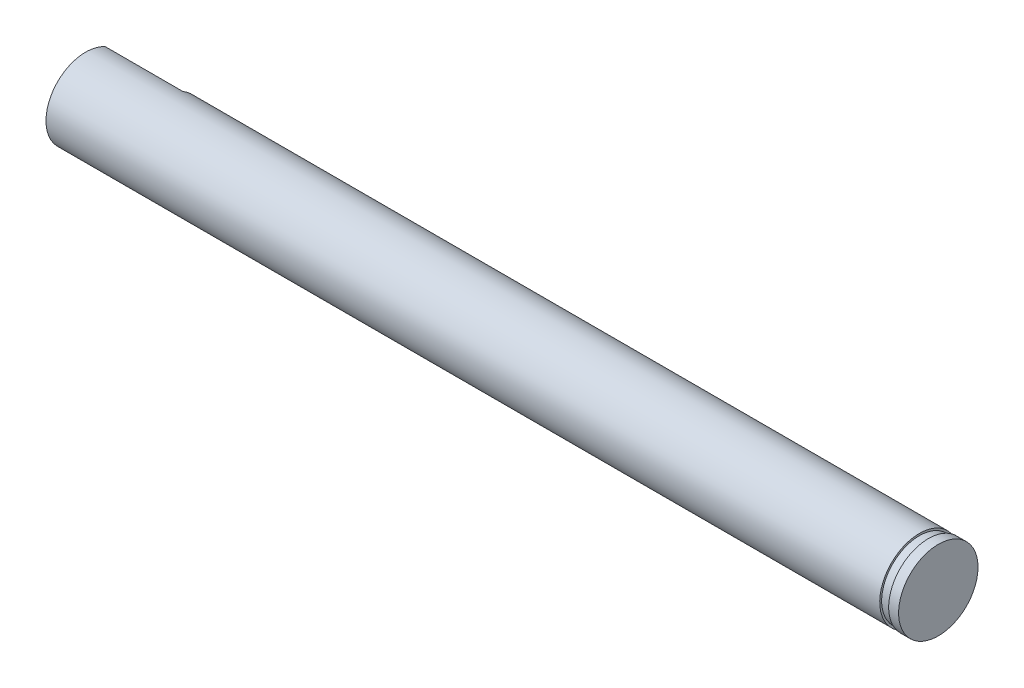
from build123d import *

# Parameters (mm, degrees)
BOSS_EXTRUDE1_DEPTH = 7.8
SKETCH2_R           = 3.995
BOSS_EXTRUDE2_DEPTH = 78
CUT_EXTRUDE1_START  = -1
SKETCH3_R           = 5
SKETCH3_R_2         = 3.8
CUT_EXTRUDE1_DEPTH  = 0.9


with BuildPart() as part:
    # Sketch1 → Boss-Extrude1 (new body)
    with BuildSketch(Plane(origin=(0, 0, 0), x_dir=(0, 0, -1), z_dir=(1, 0, 0))):
        with BuildLine():
            Line((1.985, 3.466958321), (1.985, -3.466958321))
            ThreePointArc((1.985, -3.466958321), (-3.995, 0), (1.985, 3.466958321))
        make_face()
    extrude(amount=BOSS_EXTRUDE1_DEPTH)

    # Sketch2 → Boss-Extrude2 (add)
    with BuildSketch(Plane(origin=(7.8, 0, 0), x_dir=(0, 0, -1), z_dir=(1, 0, 0))):
        with Locations(Location((0, 0, 0), (0, 0, 299.79320791))):
            Circle(SKETCH2_R)
    extrude(amount=BOSS_EXTRUDE2_DEPTH)

    # Sketch3 → Cut-Extrude1 (cut)
    with BuildSketch(Plane(origin=(85.8, 0, 0), x_dir=(0, 0, -1), z_dir=(1, 0, 0)).offset(CUT_EXTRUDE1_START)):
        Circle(SKETCH3_R)
        Circle(SKETCH3_R_2, mode=Mode.SUBTRACT)
    extrude(amount=-CUT_EXTRUDE1_DEPTH, mode=Mode.SUBTRACT)

    # Cut-Extrude2 cone 1 section (through the dimple's axis) → Cut-Extrude2 (revolve, cut)
    with BuildSketch(Plane(origin=(43.434, 0, -3.995), x_dir=(0, 1, 0), z_dir=(1, 0, 0))):
        Polygon((0, 0), (1.778, 0), (0, 1.778), align=None)
    revolve(axis=Axis((43.434, 0, -3.995), (0, 0, 1)), mode=Mode.SUBTRACT)


solid = part.part
